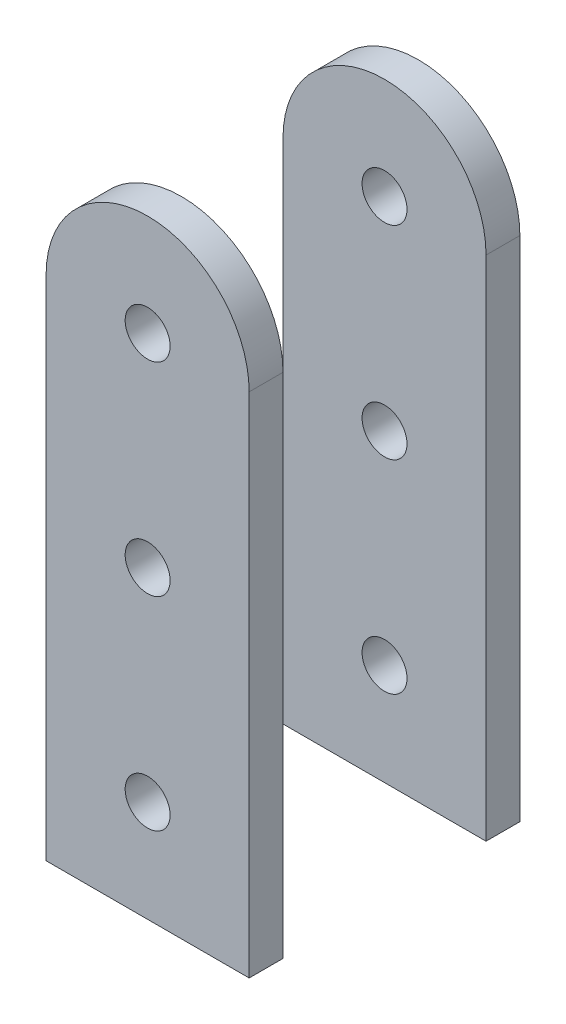
from build123d import *

# Parameters (mm, degrees)
SKETCH1_R           = 4.2164
BOSS_EXTRUDE1_DEPTH = 50.8
SKETCH2_W           = 38.1
SKETCH2_H           = 114.3
CUT_EXTRUDE1_DEPTH  = 50.8


with BuildPart() as part:
    # Sketch1 → Boss-Extrude1 (new body)
    with BuildSketch(Plane.XY):
        with BuildLine():
            Line((19.05, 47.625), (19.05, -47.625))
            Line((19.05, -47.625), (-19.05, -47.625))
            Line((-19.05, -47.625), (-19.05, 47.625))
            ThreePointArc((-19.05, 47.625), (0, 66.675), (19.05, 47.625))
        make_face()
        with Locations((0, 47.625)):
            Circle(SKETCH1_R, mode=Mode.SUBTRACT)
        with Locations((0, 9.525)):
            Circle(SKETCH1_R, mode=Mode.SUBTRACT)
        with Locations((0, -28.575)):
            Circle(SKETCH1_R, mode=Mode.SUBTRACT)
    extrude(amount=-BOSS_EXTRUDE1_DEPTH)

    # Sketch2 → Cut-Extrude1 (cut)
    with BuildSketch(Plane(origin=(19.05, 0, 0), x_dir=(0, 0, -1), z_dir=(1, 0, 0))):
        with Locations((25.4, 9.525)):
            Rectangle(SKETCH2_W, SKETCH2_H)
    extrude(amount=-CUT_EXTRUDE1_DEPTH, mode=Mode.SUBTRACT)


with BuildPart() as cut_extrude1_piece_1:
    # of the separate pieces the step leaves, piece 1, a body of its own (cut_extrude1_pieces)
    add(part.part.solids().sort_by_distance((19.05, 47.625, 0))[0])


with BuildPart() as cut_extrude1_piece_2:
    # of the separate pieces the step leaves, piece 2, a body of its own (cut_extrude1_pieces)
    add(part.part.solids().sort_by_distance((19.05, 47.625, -44.45))[0])


solid = Compound([cut_extrude1_piece_1.part, cut_extrude1_piece_2.part])
